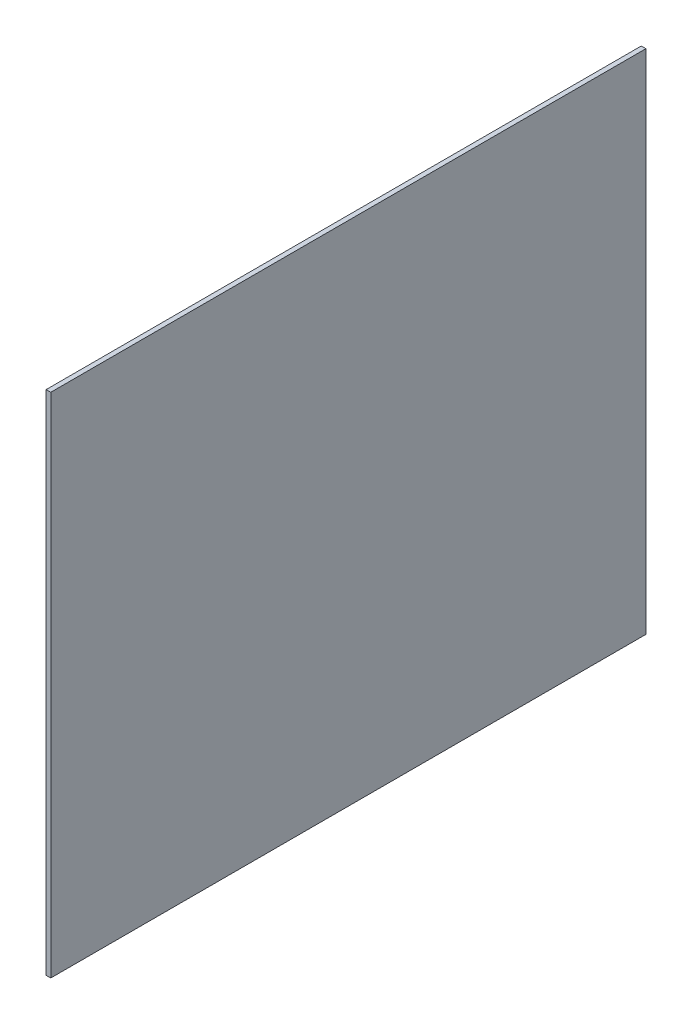
from build123d import *

# Parameters (mm, degrees)
SKETCH1_W           = 6.35
SKETCH1_H           = 692.15
BOSS_EXTRUDE1_DEPTH = 812.00752


with BuildPart() as part:
    # Sketch1 → Boss-Extrude1 (new body)
    with BuildSketch(Plane.XY):
        with Locations((-38.627150138, 291.555930694)):
            Rectangle(SKETCH1_W, SKETCH1_H)
    extrude(amount=BOSS_EXTRUDE1_DEPTH)


solid = part.part
